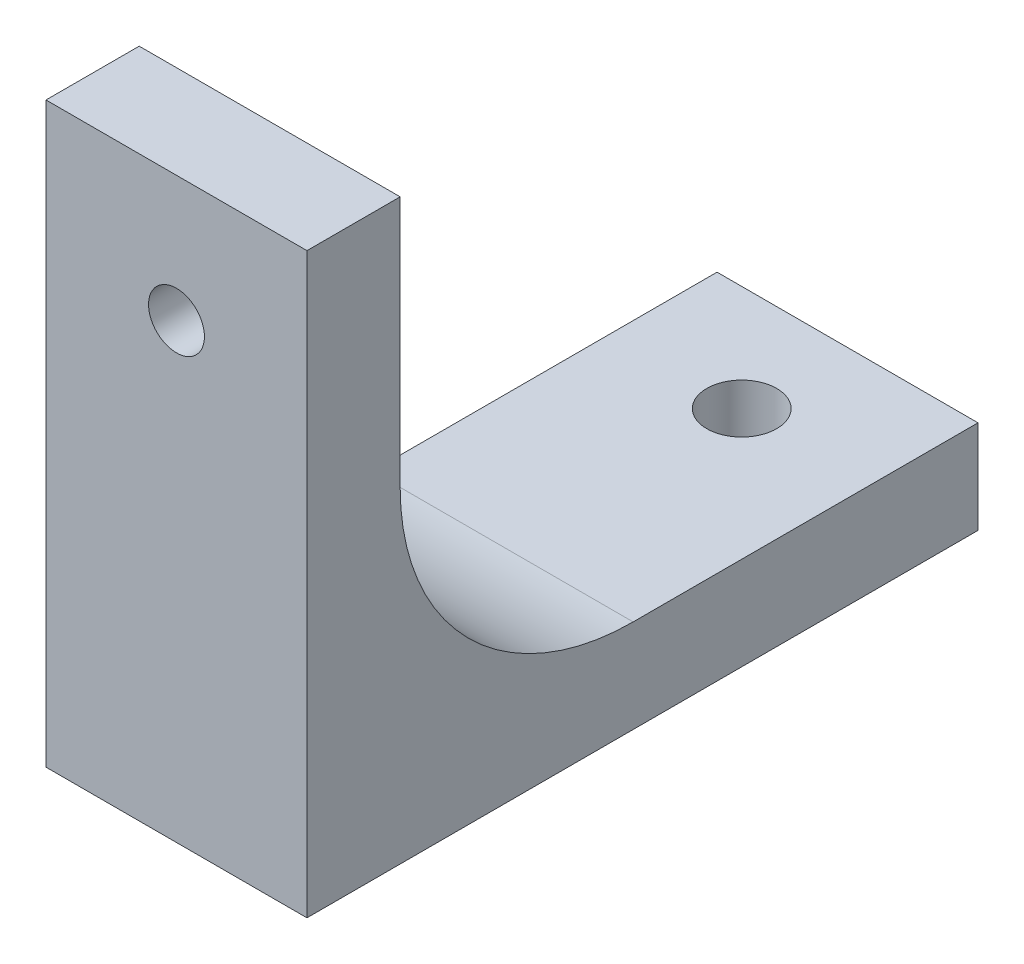
from build123d import *

# Parameters (mm, degrees)
BOSS_EXTRUDE1_DEPTH = 14.224
SKETCH2_R           = 1.524
CUT_EXTRUDE1_DEPTH  = 48.306775498
SKETCH3_R           = 1.905
CUT_EXTRUDE2_DEPTH  = 38.388604586


with BuildPart() as part:
    # Sketch1 → Boss-Extrude1 (new body)
    with BuildSketch(Plane(origin=(0, 0, 0), x_dir=(0, 0, -1), z_dir=(1, 0, 0))):
        with BuildLine():
            Line((-17.230995516, 26.416), (-17.230995516, 12.7))
            ThreePointArc((-17.230995516, 12.7), (-13.511251637, 3.719743879), (-4.530995516, 0))
            Line((-4.530995516, 0), (14.265004484, 0))
            Line((14.265004484, 0), (14.265004484, -5.08))
            Line((14.265004484, -5.08), (-17.230995516, -5.08))
            Line((-17.230995516, -5.08), (-22.310995516, -5.08))
            Line((-22.310995516, -5.08), (-22.310995516, 26.416))
            Line((-22.310995516, 26.416), (-17.230995516, 26.416))
        make_face()
    extrude(amount=BOSS_EXTRUDE1_DEPTH)

    # Sketch2 → Cut-Extrude1 (cut, through all)
    with BuildSketch(Plane.XY.offset(22.310995516)):
        with Locations((7.112, 19.558)):
            Circle(SKETCH2_R)
    extrude(amount=-CUT_EXTRUDE1_DEPTH, mode=Mode.SUBTRACT)

    # Sketch3 → Cut-Extrude2 (cut, through all)
    with BuildSketch(Plane(origin=(0, 0, 0), x_dir=(1, 0, 0), z_dir=(0, 1, 0))):
        with Locations(Location((7.112, 8.49810052, 0), (0, 0, 270))):
            Circle(SKETCH3_R)
    extrude(amount=-CUT_EXTRUDE2_DEPTH, mode=Mode.SUBTRACT)


solid = part.part
